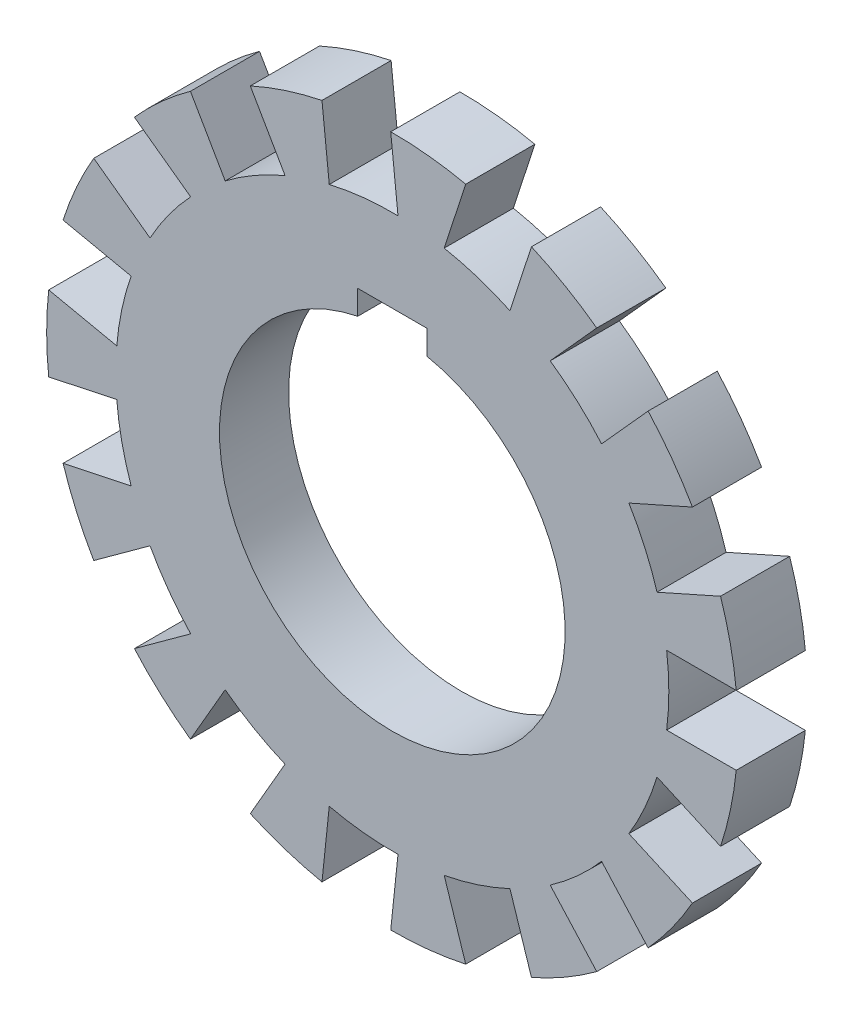
from build123d import *

# Parameters (mm, degrees)
BOSS_EXTRUDE2_DEPTH = 10


with BuildPart() as part:
    # Sketch1 → Boss-Extrude2 (new body)
    with BuildSketch(Plane.XY):
        with BuildLine():
            Line((39.686269666, -5), (49.749371855, -5))
            ThreePointArc((49.749371855, -5), (48.907380037, -10.395584541), (47.481995894, -15.667165215))
            Line((47.481995894, -15.667165215), (38.2888946, -11.574132812))
            ThreePointArc((38.2888946, -11.574132812), (36.541818306, -16.269465723), (34.221528169, -20.709587388))
            Line((34.221528169, -20.709587388), (43.414629464, -24.802619792))
            ThreePointArc((43.414629464, -24.802619792), (40.450849719, -29.389262615), (37.004551483, -33.625335233))
            Line((37.004551483, -33.625335233), (30.271021813, -26.146992913))
            ThreePointArc((30.271021813, -26.146992913), (26.765224254, -29.725793019), (22.839573558, -32.838298977))
            Line((22.839573558, -32.838298977), (29.573103228, -40.316641297))
            ThreePointArc((29.573103228, -40.316641297), (25, -43.301270189), (20.128683944, -45.769379313))
            Line((20.128683944, -45.769379313), (17.019014352, -36.198800401))
            ThreePointArc((17.019014352, -36.198800401), (12.360679775, -38.042260652), (7.508449189, -39.288970345))
            Line((7.508449189, -39.288970345), (10.618118781, -48.859549256))
            ThreePointArc((10.618118781, -48.859549256), (5.226423163, -49.726094768), (-0.227615912, -49.999481907))
            Line((-0.227615912, -49.999481907), (0.824264696, -39.991506445))
            ThreePointArc((0.824264696, -39.991506445), (-4.181138531, -39.780875815), (-9.120954258, -38.946221812))
            Line((-9.120954258, -38.946221812), (-10.172834865, -48.954197275))
            ThreePointArc((-10.172834865, -48.954197275), (-15.450849719, -47.552825815), (-20.544558909, -45.584219849))
            Line((-20.544558909, -45.584219849), (-15.513007814, -36.869317712))
            ThreePointArc((-15.513007814, -36.869317712), (-20, -34.641016151), (-24.173261852, -31.869317712))
            Line((-24.173261852, -31.869317712), (-29.204812947, -40.584219849))
            ThreePointArc((-29.204812947, -40.584219849), (-33.456530318, -37.157241274), (-37.309161029, -33.287032059))
            Line((-37.309161029, -33.287032059), (-29.167940342, -27.372089))
            ThreePointArc((-29.167940342, -27.372089), (-32.360679775, -23.511410092), (-35.045792865, -19.281919056))
            Line((-35.045792865, -19.281919056), (-43.187013552, -25.196862116))
            ThreePointArc((-43.187013552, -25.196862116), (-45.677272882, -20.336832154), (-47.622670264, -15.234214023))
            Line((-47.622670264, -15.234214023), (-37.779471002, -13.141977432))
            ThreePointArc((-37.779471002, -13.141977432), (-39.125904029, -8.316467633), (-39.85858791, -3.360501425))
            Line((-39.85858791, -3.360501425), (-49.701787172, -5.452738016))
            ThreePointArc((-49.701787172, -5.452738016), (-50, 0), (-49.701787172, 5.452738016))
            Line((-49.701787172, 5.452738016), (-39.85858791, 3.360501425))
            ThreePointArc((-39.85858791, 3.360501425), (-39.125904029, 8.316467633), (-37.779471002, 13.141977432))
            Line((-37.779471002, 13.141977432), (-47.622670264, 15.234214023))
            ThreePointArc((-47.622670264, 15.234214023), (-45.677272882, 20.336832154), (-43.187013552, 25.196862116))
            Line((-43.187013552, 25.196862116), (-35.045792865, 19.281919056))
            ThreePointArc((-35.045792865, 19.281919056), (-32.360679775, 23.511410092), (-29.167940342, 27.372089))
            Line((-29.167940342, 27.372089), (-37.309161029, 33.287032059))
            ThreePointArc((-37.309161029, 33.287032059), (-33.456530318, 37.157241274), (-29.204812947, 40.584219849))
            Line((-29.204812947, 40.584219849), (-24.173261852, 31.869317712))
            ThreePointArc((-24.173261852, 31.869317712), (-20, 34.641016151), (-15.513007814, 36.869317712))
            Line((-15.513007814, 36.869317712), (-20.544558909, 45.584219849))
            ThreePointArc((-20.544558909, 45.584219849), (-15.450849719, 47.552825815), (-10.172834865, 48.954197275))
            Line((-10.172834865, 48.954197275), (-9.120954258, 38.946221812))
            ThreePointArc((-9.120954258, 38.946221812), (-4.181138531, 39.780875815), (0.824264696, 39.991506445))
            Line((0.824264696, 39.991506445), (-0.227615912, 49.999481907))
            ThreePointArc((-0.227615912, 49.999481907), (5.226423163, 49.726094768), (10.618118781, 48.859549256))
            Line((10.618118781, 48.859549256), (7.508449189, 39.288970345))
            ThreePointArc((7.508449189, 39.288970345), (12.360679775, 38.042260652), (17.019014352, 36.198800401))
            Line((17.019014352, 36.198800401), (20.128683944, 45.769379313))
            ThreePointArc((20.128683944, 45.769379313), (25, 43.301270189), (29.573103228, 40.316641297))
            Line((29.573103228, 40.316641297), (22.839573558, 32.838298977))
            ThreePointArc((22.839573558, 32.838298977), (26.765224254, 29.725793019), (30.271021813, 26.146992913))
            Line((30.271021813, 26.146992913), (37.004551483, 33.625335233))
            ThreePointArc((37.004551483, 33.625335233), (40.450849719, 29.389262615), (43.414629464, 24.802619792))
            Line((43.414629464, 24.802619792), (34.221528169, 20.709587388))
            ThreePointArc((34.221528169, 20.709587388), (36.541818306, 16.269465723), (38.2888946, 11.574132812))
            Line((38.2888946, 11.574132812), (47.481995894, 15.667165215))
            ThreePointArc((47.481995894, 15.667165215), (48.907380037, 10.395584541), (49.749371855, 5))
            Line((49.749371855, 5), (39.686269666, 5))
            ThreePointArc((39.686269666, 5), (40, 0), (39.686269666, -5))
        make_face()
        with BuildLine():
            Line((-5, 24.494897428), (-5, 28))
            Line((-5, 28), (5, 28))
            Line((5, 28), (5, 24.494897428))
            ThreePointArc((5, 24.494897428), (0, -25), (-5, 24.494897428))
        make_face(mode=Mode.SUBTRACT)
    extrude(amount=BOSS_EXTRUDE2_DEPTH)


solid = part.part
